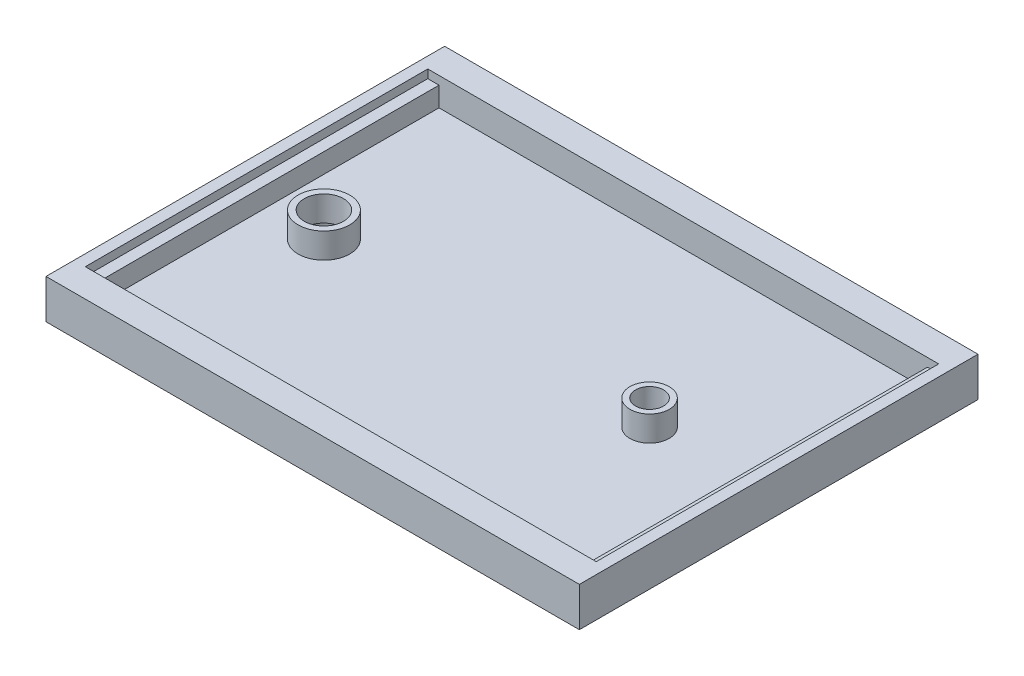
from build123d import *

# Parameters (mm, degrees)
PCB_STAND_DEPTH    = 30.5
SKETCH3_W          = 95
SKETCH3_H          = 7
EXTRA_BOTTOM_DEPTH = 5
SENSOR_HOLES_2_R   = 4.6
SENSOR_HOLES_2_R_2 = 2.5
SENSOR_HOLES_DEPTH = 60.711807878
SKETCH4_R          = 3.5
SKETCH4_R_2        = 2.5
SKETCH4_R_3        = 4.6
CYLINDER_DEPTH     = 4.5


with BuildPart() as part:
    # Master_Geometry → PCB_Stand (new, symmetric)
    with BuildSketch(Plane.XY):
        Polygon((-47.5, -5), (-47.5, 0), (-45.5, 0), (-45.5, -1.5), (-43.5, -1.5), (-43.5, -5), (43.5, -5), (43.5, -1.5), (45.5, -1.5), (45.5, 0), (47.5, 0), (47.5, -5), (47.5, -7), (-47.5, -7), align=None)
    extrude(amount=PCB_STAND_DEPTH, both=True)

    # Sketch3 → Extra_Bottom (add)
    with BuildSketch(Plane.XY.offset(30.5)):
        with Locations((0, -3.5)):
            Rectangle(SKETCH3_W, SKETCH3_H)
    extra_bottom = extrude(amount=EXTRA_BOTTOM_DEPTH)

    # Mirror2: Extra_Bottom across plane
    add(extra_bottom.mirror(Plane.XY))

    # Sensor-Holes 2 → Sensor_Holes (cut, through all)
    with BuildSketch(Plane.XZ.offset(7)):
        with Locations((-33.5, 0)):
            Circle(SENSOR_HOLES_2_R)
        with Locations((24.5, 0)):
            Circle(SENSOR_HOLES_2_R_2)
    extrude(amount=-SENSOR_HOLES_DEPTH, mode=Mode.SUBTRACT)

    # Sketch4 → Cylinder (add)
    # profile 1 of 2: a face of its own
    with BuildSketch(Plane(origin=(0, -5, 0), x_dir=(1, 0, 0), z_dir=(0, 1, 0))):
        with Locations(Location((24.5, 0, 0), (0, 0, 90))):
            Circle(SKETCH4_R)
        with Locations((24.5, 0)):
            Circle(SKETCH4_R_2, mode=Mode.SUBTRACT)
    # profile 2 of 2: a face of its own
    with BuildSketch(Plane(origin=(0, -5, 0), x_dir=(1, 0, 0), z_dir=(0, 1, 0))):
        with Locations(Location((-33.5, 0, 0), (0, 0, 270))):
            Circle(SKETCH4_R_3)
        with Locations(Location((-33.5, 0, 0), (0, 0, 270))):
            Circle(SKETCH4_R, mode=Mode.SUBTRACT)
    extrude(amount=CYLINDER_DEPTH)


with BuildPart() as cylinder_piece_1:
    # of the separate pieces the step leaves, piece 1, a body of its own (cylinder_pieces)
    add(part.part.solids().sort_by_distance((-47.5, 0, 35.5))[0])


with BuildPart() as cylinder_piece_2:
    # of the separate pieces the step leaves, piece 2, a body of its own (cylinder_pieces)
    add(part.part.solids().sort_by_distance((-33.5, -0.5, 4.6))[0])


solid = Compound([cylinder_piece_1.part, cylinder_piece_2.part])
